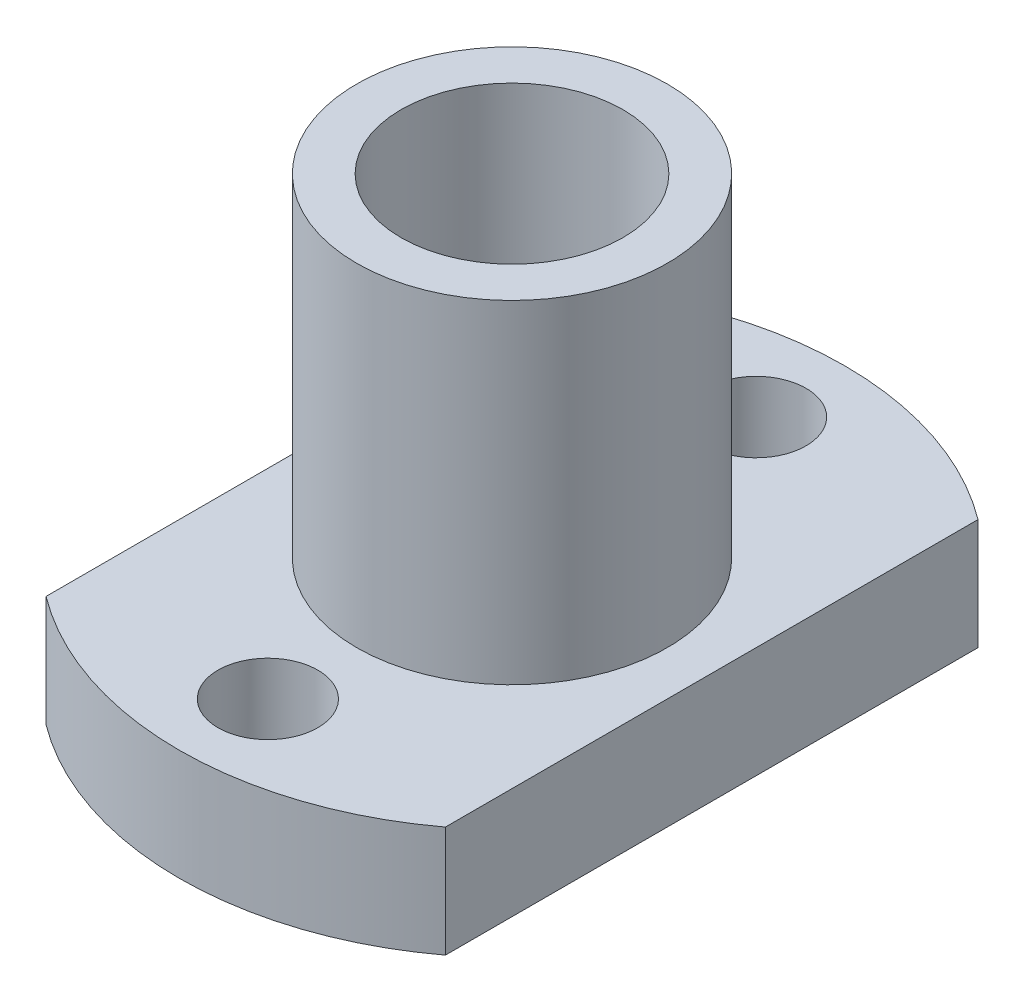
from build123d import *

# Parameters (mm, degrees)
BOSS_EXTRU_1_DEPTH      = 5
ESQUISSE2_R             = 7
BOSS_EXTRU_2_DEPTH      = 15
ESQUISSE3_R             = 5
ENL_V_MAT_EXTRU_1_DEPTH = 30
ESQUISSE4_R             = 2.25
ENL_V_MAT_EXTRU_2_DEPTH = 30


with BuildPart() as part:
    # Esquisse1 → Boss.-Extru.1 (new body)
    with BuildSketch(Plane(origin=(0, 0, 0), x_dir=(1, 0, 0), z_dir=(0, 1, 0))):
        with BuildLine():
            Line((-9, 12), (-9, -12))
            ThreePointArc((-9, -12), (0, -15), (9, -12))
            Line((9, -12), (9, 12))
            ThreePointArc((9, 12), (0, 15), (-9, 12))
        make_face()
    extrude(amount=BOSS_EXTRU_1_DEPTH)

    # Esquisse2 → Boss.-Extru.2 (add)
    with BuildSketch(Plane(origin=(0, 5, 0), x_dir=(1, 0, 0), z_dir=(0, 1, 0))):
        with Locations(Location((0, 0, 0), (0, 0, 270))):
            Circle(ESQUISSE2_R)
    extrude(amount=BOSS_EXTRU_2_DEPTH)

    # Esquisse3 → Enlèv. mat.-Extru.1 (cut)
    with BuildSketch(Plane(origin=(0, 20, 0), x_dir=(1, 0, 0), z_dir=(0, 1, 0))):
        with Locations(Location((0, 0, 0), (0, 0, 270))):
            Circle(ESQUISSE3_R)
    extrude(amount=-ENL_V_MAT_EXTRU_1_DEPTH, mode=Mode.SUBTRACT)

    # Esquisse4 → Enlèv. mat.-Extru.2 (cut)
    with BuildSketch(Plane(origin=(0, 5, 0), x_dir=(1, 0, 0), z_dir=(0, 1, 0))):
        with Locations(Location((0, 11, 0), (0, 0, 270))):
            Circle(ESQUISSE4_R)
        with Locations(Location((0, -11, 0), (0, 0, 270))):
            Circle(ESQUISSE4_R)
    extrude(amount=-ENL_V_MAT_EXTRU_2_DEPTH, mode=Mode.SUBTRACT)


solid = part.part
